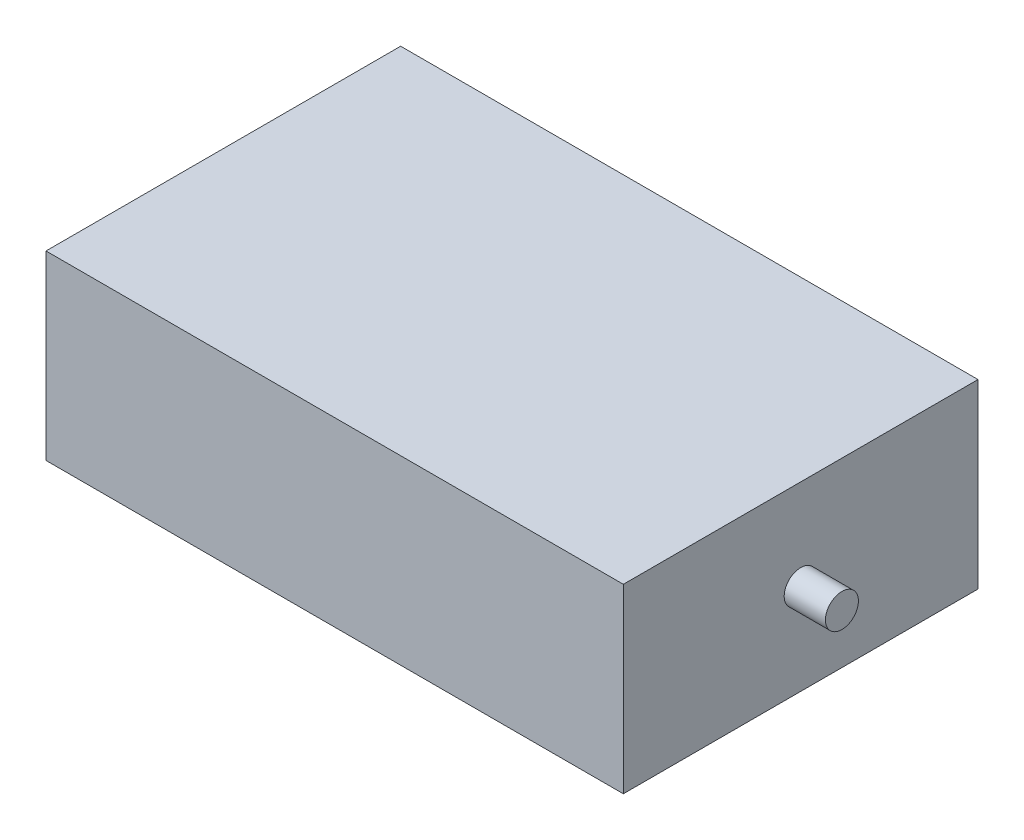
from build123d import *

# Parameters (mm, degrees)
SKETCH1_W           = 70
SKETCH1_H           = 43
BOSS_EXTRUDE1_DEPTH = 22
CUT_EXTRUDE1_DEPTH  = 1
SKETCH3_R           = 2
BOSS_EXTRUDE2_DEPTH = 5


with BuildPart() as part:
    # Sketch1 → Boss-Extrude1 (new body)
    with BuildSketch(Plane(origin=(0, 0, 0), x_dir=(1, 0, 0), z_dir=(0, 1, 0))):
        Rectangle(SKETCH1_W, SKETCH1_H)
    extrude(amount=BOSS_EXTRUDE1_DEPTH)

    # Sketch2 → Cut-Extrude1 (cut)
    # profile 1 of 5: a face of its own
    with BuildSketch(Plane.XZ):
        Polygon((-11.433264837, 5.319958889), (-11.01412922, 8.494958889), (-10.973424091, 8.494958889), (-9.66259176, 5.889830683), (-8.354939516, 8.494958889), (-8.31359837, 8.494958889), (-7.891918683, 5.319958889), (-8.178126615, 5.319958889), (-8.482143042, 7.604534209), (-9.628246808, 5.319958889), (-9.692484588, 5.319958889), (-10.843040478, 7.60962235), (-11.146420886, 5.319958889), align=None)
    # profile 2 of 5: a face of its own
    with BuildSketch(Plane.XZ):
        with BuildLine():
            add(Edge.make_bspline(
                [(-5.754899452, 8.576369145), (-5.696109242, 8.574880089), (-5.580640418, 8.571955459), (-5.410936761, 8.549567987), (-5.248925496, 8.510837169), (-5.09328687, 8.45925432), (-4.945882527, 8.390443556), (-4.80560296, 8.307272029), (-4.672781939, 8.208868384), (-4.549209686, 8.0959933), (-4.436128023, 7.973181167), (-4.336500255, 7.842119063), (-4.253004746, 7.703599435), (-4.184437639, 7.558038538), (-4.130645329, 7.405765567), (-4.093525911, 7.245968722), (-4.069814874, 7.079683368), (-4.067042848, 6.96626614), (-4.065636631, 6.908730924)],
                knots=[0, 0, 0, 0, 1.065120563, 2.091984664, 3.0946048, 4.079830382, 5.057816894, 6.036188127, 7.030412546, 8.04752943, 9.064399622, 10.05169764, 11.02544977, 11.989514704, 12.962713494, 13.945757189, 14.957906945, 16, 16, 16, 16], degree=3))
            add(Edge.make_bspline(
                [(-4.065636631, 6.908730924), (-4.067042642, 6.851619526), (-4.069814051, 6.739046345), (-4.09355287, 6.57381622), (-4.13078292, 6.414983946), (-4.183938105, 6.262814675), (-4.25217836, 6.117147885), (-4.336229837, 5.978366862), (-4.435236506, 5.84642611), (-4.547909864, 5.72277105), (-4.670737952, 5.609380487), (-4.802482551, 5.510575507), (-4.940180777, 5.425554337), (-5.085604584, 5.357714861), (-5.236825332, 5.30349319), (-5.395196439, 5.266524733), (-5.559975813, 5.24267863), (-5.672344509, 5.239940404), (-5.729458747, 5.238548632)],
                knots=[0, 0, 0, 0, 1.043624062, 2.057103931, 3.04512605, 4.022047818, 4.998200453, 5.980619268, 6.982898556, 8.009068085, 9.034988726, 10.034168286, 11.015286542, 11.987931943, 12.962482838, 13.94673481, 14.956375938, 16, 16, 16, 16], degree=3))
            add(Edge.make_bspline(
                [(-5.729458747, 5.238548632), (-5.786993665, 5.239954147), (-5.900410303, 5.242724792), (-6.066904614, 5.266475066), (-6.22681371, 5.303614678), (-6.3796803, 5.356691095), (-6.525589629, 5.425286725), (-6.664827062, 5.508929269), (-6.796833717, 5.608177176), (-6.920515158, 5.720813997), (-7.033680502, 5.843433905), (-7.132340793, 5.974819265), (-7.216002146, 6.112392429), (-7.284367454, 6.256535183), (-7.338491643, 6.406550706), (-7.375416728, 6.563439682), (-7.399307198, 6.726307663), (-7.402060238, 6.837199435), (-7.403457144, 6.893466501)],
                knots=[0, 0, 0, 0, 1.053102029, 2.075944431, 3.073151272, 4.055350789, 5.033113405, 6.020478099, 7.024410459, 8.052272461, 9.079885166, 10.07527673, 11.055994387, 12.023226415, 12.992069828, 13.970394897, 14.97016774, 16, 16, 16, 16], degree=3))
            add(Edge.make_bspline(
                [(-7.403457144, 6.893466501), (-7.402972153, 6.931233279), (-7.40200829, 7.006290391), (-7.390404398, 7.11774795), (-7.373566283, 7.227413047), (-7.349434548, 7.334973835), (-7.317873536, 7.440167014), (-7.280633483, 7.543718063), (-7.23514948, 7.644577584), (-7.183732035, 7.743223375), (-7.126344538, 7.83811769), (-7.062957251, 7.927815597), (-6.995796595, 8.013069787), (-6.922169802, 8.091670998), (-6.844503456, 8.165905815), (-6.761537641, 8.234633422), (-6.673778605, 8.298473556), (-6.580848732, 8.356004866), (-6.485037868, 8.408037795), (-6.386271077, 8.452689046), (-6.285889759, 8.491012258), (-6.183423757, 8.522073578), (-6.079145171, 8.546595497), (-5.972826409, 8.563293596), (-5.864552172, 8.574927085), (-5.791607619, 8.57588639), (-5.754899452, 8.576369145)],
                knots=[0, 0, 0, 0, 1.037015668, 2.060948919, 3.074880161, 4.083647147, 5.086022904, 6.090072063, 7.104153813, 8.122640571, 9.144368836, 10.147691507, 11.138137339, 12.123020368, 13.103399296, 14.087645067, 15.080126199, 16.082011238, 17.087798457, 18.072939717, 19.057185487, 20.037253025, 21.01195951, 21.997135196, 22.992090687, 24, 24, 24, 24], degree=3))
        make_face()
        with BuildLine():
            add(Edge.make_bspline(
                [(-5.740907064, 8.250728119), (-5.771037482, 8.250360826), (-5.831010268, 8.249629751), (-5.920168383, 8.23999978), (-6.008153923, 8.226274809), (-6.094985059, 8.206697287), (-6.180298478, 8.180023611), (-6.264889406, 8.149325072), (-6.347986462, 8.111931655), (-6.429315318, 8.069683558), (-6.508159708, 8.022921323), (-6.582556944, 7.971239792), (-6.652699629, 7.91585096), (-6.71841602, 7.856625565), (-6.779513155, 7.793261998), (-6.837193563, 7.726720859), (-6.889145255, 7.655100215), (-6.936757171, 7.580342203), (-6.979363712, 7.502544197), (-7.017250855, 7.422525251), (-7.048242492, 7.339632635), (-7.073517647, 7.254765649), (-7.094472476, 7.168058704), (-7.107747535, 7.078854041), (-7.117483319, 6.987599903), (-7.118172607, 6.92593065), (-7.118521247, 6.894738536)],
                knots=[0, 0, 0, 0, 1.008559885, 2.007477868, 2.99961109, 3.989939068, 4.984837346, 5.991145699, 7.001802488, 8.033829008, 9.059044045, 10.069351652, 11.065060232, 12.050310815, 13.029377138, 14.011219647, 14.996725999, 15.989392538, 16.977580475, 17.965360261, 18.951710183, 19.937753436, 20.929683414, 21.935841486, 22.955955122, 24, 24, 24, 24], degree=3))
            add(Edge.make_bspline(
                [(-7.118521247, 6.894738536), (-7.117364765, 6.848871379), (-7.115089607, 6.75863649), (-7.095170954, 6.62640396), (-7.064489592, 6.499323871), (-7.019261838, 6.378091568), (-6.962700923, 6.261664969), (-6.89282653, 6.151076902), (-6.810041502, 6.04629748), (-6.716003875, 5.948058201), (-6.613203991, 5.858390936), (-6.504045014, 5.779684129), (-6.389696385, 5.713090545), (-6.269859908, 5.658838801), (-6.145175355, 5.615849539), (-6.01483929, 5.586386781), (-5.879719945, 5.566996189), (-5.787617136, 5.565134046), (-5.740907064, 5.564189658)],
                knots=[0, 0, 0, 0, 1.032063989, 2.030389145, 3.003944642, 3.970395727, 4.937377036, 5.913328081, 6.909231446, 7.93887556, 8.970685674, 9.976071282, 10.964166581, 11.944589148, 12.933237628, 13.927779006, 14.949070134, 16, 16, 16, 16], degree=3))
            add(Edge.make_bspline(
                [(-5.740907064, 5.564189658), (-5.709511302, 5.564621008), (-5.647244076, 5.565476506), (-5.554628852, 5.574093162), (-5.463682146, 5.587910644), (-5.374531521, 5.607804881), (-5.287278156, 5.632703419), (-5.20155787, 5.662283286), (-5.118283707, 5.69918695), (-5.03640514, 5.739961163), (-4.958031406, 5.786443306), (-4.883214316, 5.83637077), (-4.813839677, 5.891678019), (-4.748172448, 5.950023463), (-4.686824473, 6.012583525), (-4.630210609, 6.079276869), (-4.578521489, 6.150524465), (-4.530927653, 6.225169083), (-4.488470407, 6.30317997), (-4.451477939, 6.383489035), (-4.420094319, 6.465898527), (-4.394759176, 6.55052731), (-4.374905935, 6.637214651), (-4.361226294, 6.726076622), (-4.351657353, 6.816935454), (-4.350936104, 6.878388809), (-4.350572529, 6.909366941)],
                knots=[0, 0, 0, 0, 1.047197238, 2.076906641, 3.100256066, 4.114471768, 5.12198147, 6.126382909, 7.136867548, 8.15857795, 9.17633901, 10.174870724, 11.156907918, 12.133735059, 13.104061851, 14.077631395, 15.04955518, 16.038496417, 17.029181396, 18.010275684, 18.986308667, 19.968651475, 20.955262928, 21.950658345, 22.966943676, 24, 24, 24, 24], degree=3))
            add(Edge.make_bspline(
                [(-4.350572529, 6.909366941), (-4.350936396, 6.940133149), (-4.351658192, 7.001163589), (-4.361221723, 7.09138876), (-4.374920388, 7.179611316), (-4.394662273, 7.265484908), (-4.42010777, 7.349031428), (-4.451483419, 7.430172406), (-4.488481512, 7.509210126), (-4.530943259, 7.585949238), (-4.578673327, 7.659586322), (-4.630828819, 7.729982796), (-4.688310242, 7.79581664), (-4.749475279, 7.858713112), (-4.815851725, 7.917330769), (-4.887138906, 7.971689056), (-4.962471385, 8.023099812), (-5.042233949, 8.069478), (-5.124551678, 8.112308054), (-5.20901934, 8.149002893), (-5.294680023, 8.180183315), (-5.381315897, 8.206777991), (-5.46965617, 8.226198132), (-5.559103929, 8.240012149), (-5.649535421, 8.249626399), (-5.710353199, 8.250359714), (-5.740907064, 8.250728119)],
                knots=[0, 0, 0, 0, 1.02996197, 2.043119294, 3.035359645, 4.018872909, 4.991431989, 5.957985074, 6.929999688, 7.912076566, 8.892894881, 9.867085534, 10.843653904, 11.817741046, 12.803660682, 13.806313499, 14.818574707, 15.856120519, 16.894564902, 17.924820532, 18.937903209, 19.946497019, 20.957711757, 21.963978472, 22.977135795, 24, 24, 24, 24], degree=3))
        make_face(mode=Mode.SUBTRACT)
    # profile 3 of 5: a face of its own
    with BuildSketch(Plane.XZ):
        Polygon((-3.780700734, 8.169317863), (-3.780700734, 8.494958889), (-2.111790478, 8.494958889), (-2.111790478, 8.169317863), (-2.803777657, 8.169317863), (-2.803777657, 5.319958889), (-3.088713554, 5.319958889), (-3.088713554, 8.169317863), align=None)
    # profile 4 of 5: a face of its own
    with BuildSketch(Plane.XZ):
        with BuildLine():
            add(Edge.make_bspline(
                [(-0.13759176, 8.576369145), (-0.078801549, 8.574880089), (0.036667274, 8.571955459), (0.206370932, 8.549567987), (0.368382197, 8.510837169), (0.524020822, 8.45925432), (0.671425166, 8.390443556), (0.811704732, 8.307272029), (0.944525754, 8.208868384), (1.068098007, 8.0959933), (1.181179669, 7.973181167), (1.280807437, 7.842119063), (1.364302946, 7.703599435), (1.432870053, 7.558038538), (1.486662364, 7.405765567), (1.523781782, 7.245968722), (1.547492818, 7.079683368), (1.550264845, 6.96626614), (1.551671061, 6.908730924)],
                knots=[0, 0, 0, 0, 1.065120563, 2.091984664, 3.0946048, 4.079830382, 5.057816894, 6.036188127, 7.030412546, 8.04752943, 9.064399622, 10.05169764, 11.02544977, 11.989514704, 12.962713494, 13.945757189, 14.957906945, 16, 16, 16, 16], degree=3))
            add(Edge.make_bspline(
                [(1.551671061, 6.908730924), (1.550265051, 6.851619526), (1.547493642, 6.739046345), (1.523754822, 6.57381622), (1.486524772, 6.414983946), (1.433369588, 6.262814675), (1.365129332, 6.117147885), (1.281077856, 5.978366862), (1.182071186, 5.84642611), (1.069397828, 5.72277105), (0.94656974, 5.609380487), (0.814825141, 5.510575507), (0.677126915, 5.425554337), (0.531703108, 5.357714861), (0.380482361, 5.30349319), (0.222111253, 5.266524733), (0.057331879, 5.24267863), (-0.055036817, 5.239940404), (-0.112151054, 5.238548632)],
                knots=[0, 0, 0, 0, 1.043624062, 2.057103931, 3.04512605, 4.022047818, 4.998200453, 5.980619268, 6.982898556, 8.009068085, 9.034988726, 10.034168286, 11.015286542, 11.987931943, 12.962482838, 13.94673481, 14.956375938, 16, 16, 16, 16], degree=3))
            add(Edge.make_bspline(
                [(-0.112151054, 5.238548632), (-0.169685972, 5.239954147), (-0.283102611, 5.242724792), (-0.449596922, 5.266475066), (-0.609506018, 5.303614678), (-0.762372608, 5.356691095), (-0.908281937, 5.425286725), (-1.047519369, 5.508929269), (-1.179526024, 5.608177176), (-1.303207466, 5.720813997), (-1.41637281, 5.843433905), (-1.515033101, 5.974819265), (-1.598694453, 6.112392429), (-1.667059762, 6.256535183), (-1.72118395, 6.406550706), (-1.758109035, 6.563439682), (-1.781999506, 6.726307663), (-1.784752545, 6.837199435), (-1.786149452, 6.893466501)],
                knots=[0, 0, 0, 0, 1.053102029, 2.075944431, 3.073151272, 4.055350789, 5.033113405, 6.020478099, 7.024410459, 8.052272461, 9.079885166, 10.07527673, 11.055994387, 12.023226415, 12.992069828, 13.970394897, 14.97016774, 16, 16, 16, 16], degree=3))
            add(Edge.make_bspline(
                [(-1.786149452, 6.893466501), (-1.785664461, 6.931233279), (-1.784700598, 7.006290391), (-1.773096706, 7.11774795), (-1.756258591, 7.227413047), (-1.732126856, 7.334973835), (-1.700565844, 7.440167014), (-1.66332579, 7.543718063), (-1.617841788, 7.644577584), (-1.566424343, 7.743223375), (-1.509036845, 7.83811769), (-1.445649558, 7.927815597), (-1.378488903, 8.013069787), (-1.30486211, 8.091670998), (-1.227195763, 8.165905815), (-1.144229949, 8.234633422), (-1.056470913, 8.298473556), (-0.96354104, 8.356004866), (-0.867730176, 8.408037795), (-0.768963385, 8.452689046), (-0.668582066, 8.491012258), (-0.566116064, 8.522073578), (-0.461837478, 8.546595497), (-0.355518717, 8.563293596), (-0.24724448, 8.574927085), (-0.174299926, 8.57588639), (-0.13759176, 8.576369145)],
                knots=[0, 0, 0, 0, 1.037015668, 2.060948919, 3.074880161, 4.083647147, 5.086022904, 6.090072063, 7.104153813, 8.122640571, 9.144368836, 10.147691507, 11.138137339, 12.123020368, 13.103399296, 14.087645067, 15.080126199, 16.082011238, 17.087798457, 18.072939717, 19.057185487, 20.037253025, 21.01195951, 21.997135196, 22.992090687, 24, 24, 24, 24], degree=3))
        make_face()
        with BuildLine():
            add(Edge.make_bspline(
                [(-0.123599372, 8.250728119), (-0.153729789, 8.250360826), (-0.213702576, 8.249629751), (-0.302860691, 8.23999978), (-0.390846231, 8.226274809), (-0.477677366, 8.206697287), (-0.562990786, 8.180023611), (-0.647581713, 8.149325072), (-0.730678769, 8.111931655), (-0.812007626, 8.069683558), (-0.890852016, 8.022921323), (-0.965249252, 7.971239792), (-1.035391936, 7.91585096), (-1.101108328, 7.856625565), (-1.162205463, 7.793261998), (-1.219885871, 7.726720859), (-1.271837563, 7.655100215), (-1.319449479, 7.580342203), (-1.362056019, 7.502544197), (-1.399943163, 7.422525251), (-1.430934799, 7.339632635), (-1.456209955, 7.254765649), (-1.477164783, 7.168058704), (-1.490439843, 7.078854041), (-1.500175626, 6.987599903), (-1.500864915, 6.92593065), (-1.501213554, 6.894738536)],
                knots=[0, 0, 0, 0, 1.008559885, 2.007477868, 2.99961109, 3.989939068, 4.984837346, 5.991145699, 7.001802488, 8.033829008, 9.059044045, 10.069351652, 11.065060232, 12.050310815, 13.029377138, 14.011219647, 14.996725999, 15.989392538, 16.977580475, 17.965360261, 18.951710183, 19.937753436, 20.929683414, 21.935841486, 22.955955122, 24, 24, 24, 24], degree=3))
            add(Edge.make_bspline(
                [(-1.501213554, 6.894738536), (-1.500057073, 6.848871379), (-1.497781915, 6.75863649), (-1.477863262, 6.62640396), (-1.447181899, 6.499323871), (-1.401954146, 6.378091568), (-1.345393231, 6.261664969), (-1.275518838, 6.151076902), (-1.19273381, 6.04629748), (-1.098696182, 5.948058201), (-0.995896298, 5.858390936), (-0.886737322, 5.779684129), (-0.772388692, 5.713090545), (-0.652552216, 5.658838801), (-0.527867662, 5.615849539), (-0.397531598, 5.586386781), (-0.262412253, 5.566996189), (-0.170309444, 5.565134046), (-0.123599372, 5.564189658)],
                knots=[0, 0, 0, 0, 1.032063989, 2.030389145, 3.003944642, 3.970395727, 4.937377036, 5.913328081, 6.909231446, 7.93887556, 8.970685674, 9.976071282, 10.964166581, 11.944589148, 12.933237628, 13.927779006, 14.949070134, 16, 16, 16, 16], degree=3))
            add(Edge.make_bspline(
                [(-0.123599372, 5.564189658), (-0.09220361, 5.564621008), (-0.029936384, 5.565476506), (0.06267884, 5.574093162), (0.153625546, 5.587910644), (0.242776172, 5.607804881), (0.330029536, 5.632703419), (0.415749822, 5.662283286), (0.499023985, 5.69918695), (0.580902553, 5.739961163), (0.659276286, 5.786443306), (0.734093376, 5.83637077), (0.803468015, 5.891678019), (0.869135244, 5.950023463), (0.930483219, 6.012583525), (0.987097083, 6.079276869), (1.038786203, 6.150524465), (1.08638004, 6.225169083), (1.128837285, 6.30317997), (1.165829754, 6.383489035), (1.197213373, 6.465898527), (1.222548517, 6.55052731), (1.242401757, 6.637214651), (1.256081399, 6.726076622), (1.265650339, 6.816935454), (1.266371588, 6.878388809), (1.266735163, 6.909366941)],
                knots=[0, 0, 0, 0, 1.047197238, 2.076906641, 3.100256066, 4.114471768, 5.12198147, 6.126382909, 7.136867548, 8.15857795, 9.17633901, 10.174870724, 11.156907918, 12.133735059, 13.104061851, 14.077631395, 15.04955518, 16.038496417, 17.029181396, 18.010275684, 18.986308667, 19.968651475, 20.955262928, 21.950658345, 22.966943676, 24, 24, 24, 24], degree=3))
            add(Edge.make_bspline(
                [(1.266735163, 6.909366941), (1.266371297, 6.940133149), (1.2656495, 7.001163589), (1.256085969, 7.09138876), (1.242387305, 7.179611316), (1.222645419, 7.265484908), (1.197199923, 7.349031428), (1.165824273, 7.430172406), (1.12882618, 7.509210126), (1.086364434, 7.585949238), (1.038634365, 7.659586322), (0.986478873, 7.729982796), (0.92899745, 7.79581664), (0.867832413, 7.858713112), (0.801455967, 7.917330769), (0.730168786, 7.971689056), (0.654836307, 8.023099812), (0.575073743, 8.069478), (0.492756014, 8.112308054), (0.408288352, 8.149002893), (0.322627669, 8.180183315), (0.235991796, 8.206777991), (0.147651522, 8.226198132), (0.058203763, 8.240012149), (-0.032227728, 8.249626399), (-0.093045506, 8.250359714), (-0.123599372, 8.250728119)],
                knots=[0, 0, 0, 0, 1.02996197, 2.043119294, 3.035359645, 4.018872909, 4.991431989, 5.957985074, 6.929999688, 7.912076566, 8.892894881, 9.867085534, 10.843653904, 11.817741046, 12.803660682, 13.806313499, 14.818574707, 15.856120519, 16.894564902, 17.924820532, 18.937903209, 19.946497019, 20.957711757, 21.963978472, 22.977135795, 24, 24, 24, 24], degree=3))
        make_face(mode=Mode.SUBTRACT)
    # profile 5 of 5: a face of its own
    with BuildSketch(Plane.XZ):
        with BuildLine():
            Line((2.202953112, 8.494958889), (2.838334723, 8.494958889))
            add(Edge.make_bspline(
                [(2.838334723, 8.494958889), (2.880735604, 8.49481775), (2.962149992, 8.494546748), (3.078784316, 8.493035663), (3.184763182, 8.48870464), (3.280031179, 8.484977568), (3.364586559, 8.478181307), (3.438688601, 8.471685577), (3.501996013, 8.463182328), (3.540319035, 8.455285265), (3.55767066, 8.45170969)],
                knots=[0, 0, 0, 0, 1.410062039, 2.707475311, 3.878576406, 4.937260626, 5.877586885, 6.699081471, 7.410979367, 8, 8, 8, 8], degree=3))
            add(Edge.make_bspline(
                [(3.55767066, 8.45170969), (3.580899526, 8.44597041), (3.626861724, 8.434614284), (3.693037855, 8.410611646), (3.756097278, 8.382835273), (3.815778047, 8.350211041), (3.871781229, 8.312496776), (3.924684268, 8.270343551), (3.974727224, 8.223982014), (4.019886274, 8.172243265), (4.0624667, 8.117963003), (4.09837924, 8.059267452), (4.129336832, 7.99788878), (4.153984372, 7.933202766), (4.17383082, 7.86583673), (4.187824623, 7.795180464), (4.196216771, 7.721555865), (4.197071169, 7.671338334), (4.197504394, 7.645875355)],
                knots=[0, 0, 0, 0, 1.027469482, 2.033020251, 3.019912614, 3.986113645, 4.951240523, 5.91722682, 6.890402269, 7.87763091, 8.8651537, 9.85103654, 10.82876324, 11.815024772, 12.821070561, 13.842952187, 14.906261191, 16, 16, 16, 16], degree=3))
            add(Edge.make_bspline(
                [(4.197504394, 7.645875355), (4.196171803, 7.603570653), (4.193571573, 7.521023222), (4.169328086, 7.401225137), (4.129616529, 7.28947483), (4.074894688, 7.185913008), (4.005208449, 7.092558351), (3.921456674, 7.010561296), (3.823592641, 6.941945089), (3.732488904, 6.894362902), (3.652012452, 6.863889335), (3.585760804, 6.842447781), (3.513491474, 6.825881569), (3.435896892, 6.811040593), (3.352654148, 6.799835841), (3.263962755, 6.791629288), (3.16975946, 6.786500258), (3.105044733, 6.785736439), (3.071753192, 6.785343504)],
                knots=[0, 0, 0, 0, 1.260483769, 2.459530307, 3.627416485, 4.787058657, 5.939039949, 7.08810263, 8.267026773, 9.491475466, 10.141966685, 10.831826277, 11.566392101, 12.351337768, 13.187381173, 14.07005841, 15.007169909, 16, 16, 16, 16], degree=3))
            Line((3.071753192, 6.785343504), (4.238209522, 5.319958889))
            Line((4.238209522, 5.319958889), (3.885855756, 5.319958889))
            Line((3.885855756, 5.319958889), (2.719399426, 6.785343504))
            Line((2.719399426, 6.785343504), (2.48788901, 6.785343504))
            Line((2.48788901, 6.785343504), (2.48788901, 5.319958889))
            Line((2.48788901, 5.319958889), (2.202953112, 5.319958889))
            Line((2.202953112, 5.319958889), (2.202953112, 8.494958889))
        make_face()
        with BuildLine():
            Line((2.48788901, 8.169317863), (2.48788901, 7.11098453))
            Line((2.48788901, 7.11098453), (3.069209122, 7.106532406))
            add(Edge.make_bspline(
                [(3.069209122, 7.106532406), (3.096350871, 7.106520399), (3.148959312, 7.106497125), (3.225069201, 7.11012005), (3.295935303, 7.114241489), (3.361286556, 7.120545538), (3.421152157, 7.128669975), (3.475502182, 7.138832682), (3.52442535, 7.150672767), (3.58148331, 7.168998528), (3.645197878, 7.198032558), (3.714441416, 7.240274118), (3.773407823, 7.293404676), (3.823226169, 7.354159168), (3.863257868, 7.420957766), (3.891480946, 7.492999758), (3.909390161, 7.568466422), (3.911502485, 7.620335134), (3.912568497, 7.646511372)],
                knots=[0, 0, 0, 0, 1.146690395, 2.22261258, 3.21895312, 4.145990853, 4.996080663, 5.770904154, 6.481378293, 7.121626537, 8.300444488, 9.431385265, 10.535395872, 11.636531494, 12.74115979, 13.810798291, 14.895190096, 16, 16, 16, 16], degree=3))
            add(Edge.make_bspline(
                [(3.912568497, 7.646511372), (3.911478001, 7.672044336), (3.909317037, 7.722641352), (3.891674226, 7.796714928), (3.861838858, 7.866625661), (3.821632257, 7.932089159), (3.772647309, 7.991512219), (3.715209007, 8.042354993), (3.650887866, 8.084309865), (3.590770422, 8.11111991), (3.537036529, 8.127557206), (3.49038248, 8.139124333), (3.437667068, 8.14841753), (3.378634331, 8.155863413), (3.31353628, 8.162263256), (3.242043761, 8.166573798), (3.16463111, 8.169126374), (3.110976394, 8.169252548), (3.08320151, 8.169317863)],
                knots=[0, 0, 0, 0, 1.101028733, 2.181837193, 3.264309656, 4.369019818, 5.486613113, 6.575447106, 7.666700264, 8.788928104, 9.402425223, 10.0903467, 10.862060571, 11.710948788, 12.657782767, 13.684531032, 14.801375019, 16, 16, 16, 16], degree=3))
            Line((3.08320151, 8.169317863), (2.48788901, 8.169317863))
        make_face(mode=Mode.SUBTRACT)
    extrude(amount=-CUT_EXTRUDE1_DEPTH, mode=Mode.SUBTRACT)

    # Sketch3 → Boss-Extrude2 (add)
    with BuildSketch(Plane(origin=(35, 0, 0), x_dir=(0, 0, -1), z_dir=(1, 0, 0))):
        with Locations(Location((0, 11, 0), (0, 0, 180))):
            Circle(SKETCH3_R)
    extrude(amount=BOSS_EXTRUDE2_DEPTH)


solid = part.part
